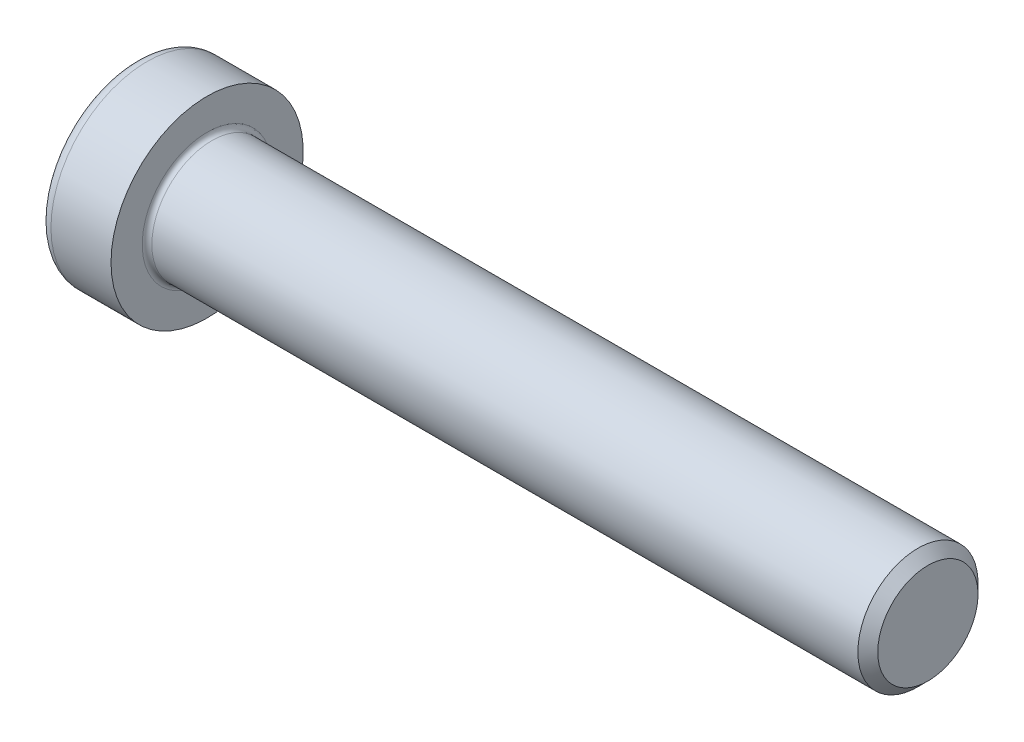
from build123d import *

# Parameters (mm, degrees)
FILLET1_R   = 0.4
FILLET2_R   = 1
HEX_2_DEPTH = 4.5


with BuildPart() as part:
    # BodySke → Base-Revolve (revolve)
    with BuildSketch(Plane.XY, mode=Mode.PRIVATE) as base_revolve_sk:
        Polygon((0, 0), (0, 8), (6, 8), (6, 5), (65.172, 5), (66, 4.172), (66, 0), align=None)
    revolve(base_revolve_sk.sketch.rotate(Axis((-31.75, 0, 0), (1, 0, 0)), 90), axis=Axis((-31.75, 0, 0), (1, 0, 0)))

    # Fillet1
    fillet1_edges = [part.edges().sort_by_distance(p)[0] for p in [
        (6, 0, -5),
    ]]
    fillet(fillet1_edges, radius=FILLET1_R)

    # Fillet2
    fillet2_edges = [part.edges().sort_by_distance(p)[0] for p in [
        (0, 0, -8),
    ]]
    fillet(fillet2_edges, radius=FILLET2_R)

    # Sketch2 → Hex-PreBroach (revolve, cut)
    with BuildSketch(Plane.XY, mode=Mode.PRIVATE) as hex_prebroach_sk:
        Polygon((0, 3.5), (4.5, 3.5), (6.520725942, 0), (0, 0), align=None)
    revolve(hex_prebroach_sk.sketch.rotate(Axis((0, 0, 0), (1, 0, 0)), 90), axis=Axis((0, 0, 0), (1, 0, 0)), mode=Mode.SUBTRACT)

    # Sketch3 → Hex 2 (cut)
    with BuildSketch(Plane(origin=(0, 0, 0), x_dir=(0, 0.500000000000001, 0.866025403784438), z_dir=(-1, 0, 0))):
        Polygon((2.020725942, 3.5), (-2.020725942, 3.5), (-4.041451884, 0), (-2.020725942, -3.5), (2.020725942, -3.5), (4.041451884, 0), align=None)
    extrude(amount=-HEX_2_DEPTH, mode=Mode.SUBTRACT)


solid = part.part
